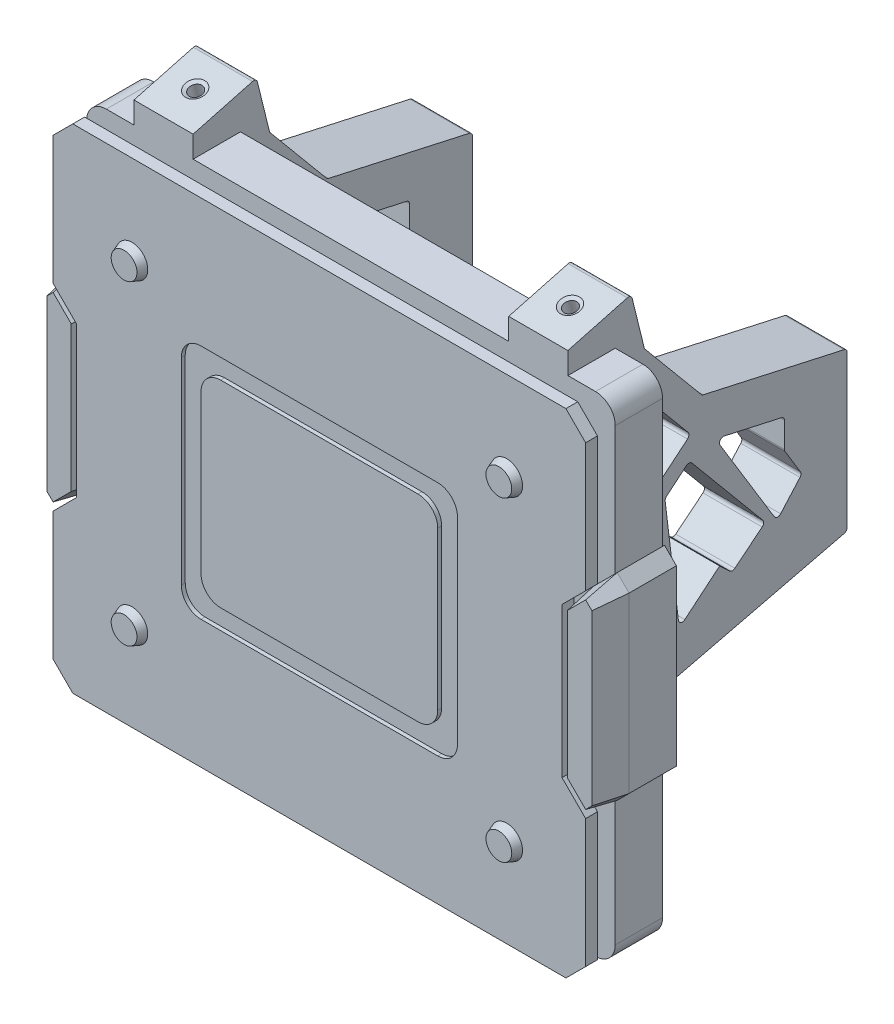
from build123d import *

# Parameters (mm, degrees)
SKETCH_1_W                  = 135
SKETCH_1_H                  = 125
EXTRUDE_1_DEPTH             = 3
SKETCH_3_R                  = 4
EXTRUDE_2_DEPTH             = 2
EXTRUDE_2_DRAFT             = 20
EXTRUDE_2_PROFILE_2_DEPTH   = 2
EXTRUDE_2_PROFILE_2_DRAFT   = 20
EXTRUDE_2_PROFILE_3_DEPTH   = 2
EXTRUDE_2_PROFILE_3_DRAFT   = 20
EXTRUDE_2_PROFILE_4_DEPTH   = 2
EXTRUDE_2_PROFILE_4_DRAFT   = 20
CHAMFER_1_SIZE              = 5
SKETCH_5_W                  = 15
SKETCH_5_H                  = 15
EXTRUDE_4_DEPTH             = 5
MIRROR_3_COPY_1_SKETCH_W    = 15
MIRROR_3_COPY_1_SKETCH_H    = 15
MIRROR_3_COPY_1_DEPTH       = 5
SKETCH_6_W                  = 134
SKETCH_6_H                  = 124
EXTRUDE_6_DEPTH             = 12
FILLET_1_R                  = 5
CUT_EXTRUDE_1_DEPTH         = 1
CUT_EXTRUDE_2_DEPTH         = 3
EXTRUDE_7_DEPTH             = 8
EXTRUDE_7_TAPER             = 10
EXTRUDE_10_REACH            = 98.75
EXTRUDE_11_DEPTH            = 7.5
CUT_EXTRUDE_3_REACH         = 165.252
HOLE_WIZARD_M4_1_AT_2_COUNT = 2
HOLE_WIZARD_M4_1_AT_2_PITCH = 25
HOLE_WIZARD_M4_3_AT_2_COUNT = 2
HOLE_WIZARD_M4_3_AT_2_PITCH = 25
FILLET_2_R                  = 1
FILLET_2_OF_MIRROR_6_R      = 1
SKETCH_24_W                 = 135
SKETCH_24_H                 = 125
EXTRUDE_12_DEPTH            = 150
EXTRUDE_12_TAPER            = -55


with BuildPart() as part:
    # 草图1 → 凸台-拉伸1 (new body)
    with BuildSketch(Plane.XY):
        Rectangle(SKETCH_1_W, SKETCH_1_H)
    extrude(amount=EXTRUDE_1_DEPTH)


with BuildPart() as extrude_2_tool:
    # 草图3 → 凸台-拉伸2 (with draft: the straight prism first)
    with BuildSketch(Plane.XY.offset(3)):
        with Locations((-47.5, 40)):
            Circle(SKETCH_3_R)
    extrude(amount=EXTRUDE_2_DEPTH)
    # 凸台-拉伸2: the draft: its side faces are tilted about the plane it starts from
    extrude_2_sides = [extrude_2_tool.faces().sort_by_distance(p)[0] for p in [
        (-51.5, 40, 4),
    ]]
    draft(extrude_2_sides, Plane.XY.offset(3), EXTRUDE_2_DRAFT)


with BuildPart() as part_1:
    add(part.part)

    # 凸台-拉伸2: add extrude_2_tool
    add(extrude_2_tool.part)


with BuildPart() as extrude_2_profile_2_tool:
    # 草图3 → 凸台-拉伸2 profile 2 (with draft: the straight prism first)
    with BuildSketch(Plane.XY.offset(3)):
        with Locations((47.5, 40)):
            Circle(SKETCH_3_R)
    extrude(amount=EXTRUDE_2_PROFILE_2_DEPTH)
    # 凸台-拉伸2 profile 2: the draft: its side faces are tilted about the plane it starts from
    extrude_2_profile_2_sides = [extrude_2_profile_2_tool.faces().sort_by_distance(p)[0] for p in [
        (43.5, 40, 4),
    ]]
    draft(extrude_2_profile_2_sides, Plane.XY.offset(3), EXTRUDE_2_PROFILE_2_DRAFT)


with BuildPart() as part_2:
    add(part_1.part)

    # 凸台-拉伸2 profile 2: add extrude_2_profile_2_tool
    add(extrude_2_profile_2_tool.part)


with BuildPart() as extrude_2_profile_3_tool:
    # 草图3 → 凸台-拉伸2 profile 3 (with draft: the straight prism first)
    with BuildSketch(Plane.XY.offset(3)):
        with Locations((47.5, -40)):
            Circle(SKETCH_3_R)
    extrude(amount=EXTRUDE_2_PROFILE_3_DEPTH)
    # 凸台-拉伸2 profile 3: the draft: its side faces are tilted about the plane it starts from
    extrude_2_profile_3_sides = [extrude_2_profile_3_tool.faces().sort_by_distance(p)[0] for p in [
        (43.5, -40, 4),
    ]]
    draft(extrude_2_profile_3_sides, Plane.XY.offset(3), EXTRUDE_2_PROFILE_3_DRAFT)


with BuildPart() as part_3:
    add(part_2.part)

    # 凸台-拉伸2 profile 3: add extrude_2_profile_3_tool
    add(extrude_2_profile_3_tool.part)


with BuildPart() as extrude_2_profile_4_tool:
    # 草图3 → 凸台-拉伸2 profile 4 (with draft: the straight prism first)
    with BuildSketch(Plane.XY.offset(3)):
        with Locations((-47.5, -40)):
            Circle(SKETCH_3_R)
    extrude(amount=EXTRUDE_2_PROFILE_4_DEPTH)
    # 凸台-拉伸2 profile 4: the draft: its side faces are tilted about the plane it starts from
    extrude_2_profile_4_sides = [extrude_2_profile_4_tool.faces().sort_by_distance(p)[0] for p in [
        (-51.5, -40, 4),
    ]]
    draft(extrude_2_profile_4_sides, Plane.XY.offset(3), EXTRUDE_2_PROFILE_4_DRAFT)


with BuildPart() as part_4:
    add(part_3.part)

    # 凸台-拉伸2 profile 4: add extrude_2_profile_4_tool
    add(extrude_2_profile_4_tool.part)

    # 倒角1
    chamfer_1_edges = [part_4.edges().sort_by_distance(p)[0] for p in [
        (67.5, -62.5, 1.5),
        (-67.5, -62.5, 1.5),
        (-67.5, 62.5, 1.5),
        (67.5, 62.5, 1.5),
    ]]
    chamfer(chamfer_1_edges, length=CHAMFER_1_SIZE)

    # 草图5 → 凸台-拉伸4 (add)
    with BuildSketch(Plane(origin=(0, 0, 0), x_dir=(-1, 0, 0), z_dir=(0, 0, -1))):
        with Locations((47.5, 40)):
            Rectangle(SKETCH_5_W, SKETCH_5_H)
    extrude_4 = extrude(amount=EXTRUDE_4_DEPTH)

    # 镜向2: 凸台-拉伸4 across plane
    add(extrude_4.mirror(Plane(origin=(0, 0, 0), x_dir=(0, 0, 1), z_dir=(1, 0, 0))))

    # 镜向3: 凸台-拉伸4 across plane
    add(extrude_4.mirror(Plane.ZX))

    # 镜向3 copy 1 sketch → 镜向3 copy 1 (add)
    with BuildSketch(Plane(origin=(0, 0, 0), x_dir=(1, 0, 0), z_dir=(0, 0, -1))):
        with Locations((47.5, 40)):
            Rectangle(MIRROR_3_COPY_1_SKETCH_W, MIRROR_3_COPY_1_SKETCH_H)
    extrude(amount=MIRROR_3_COPY_1_DEPTH)

    # 草图6 → 凸台-拉伸6 (add)
    with BuildSketch(Plane(origin=(0, 0, -5), x_dir=(-1, 0, 0), z_dir=(0, 0, -1))):
        Rectangle(SKETCH_6_W, SKETCH_6_H)
    extrude(amount=EXTRUDE_6_DEPTH)

    # 圆角1
    fillet_1_edges = [part_4.edges().sort_by_distance(p)[0] for p in [
        (-67, -62, -11),
        (-67, 62, -11),
        (67, 62, -11),
        (67, -62, -11),
    ]]
    fillet(fillet_1_edges, radius=FILLET_1_R)

    # 草图7 → 切除-拉伸1 (cut)
    with BuildSketch(Plane.XY.offset(3)):
        with BuildLine():
            Line((-30, -30), (30, -30))
            ThreePointArc((30, -30), (33.535533906, -28.535533906), (35, -25))
            Line((35, -25), (35, 25))
            ThreePointArc((35, 25), (33.535533906, 28.535533906), (30, 30))
            Line((30, 30), (-30, 30))
            ThreePointArc((-30, 30), (-33.535533906, 28.535533906), (-35, 25))
            Line((-35, 25), (-35, -25))
            ThreePointArc((-35, -25), (-33.535533906, -28.535533906), (-30, -30))
        make_face()
        with BuildLine():
            Line((-25, -25), (25, -25))
            ThreePointArc((25, -25), (28.535533906, -23.535533906), (30, -20))
            Line((30, -20), (30, 20))
            ThreePointArc((30, 20), (28.535533906, 23.535533906), (25, 25))
            Line((25, 25), (-25, 25))
            ThreePointArc((-25, 25), (-28.535533906, 23.535533906), (-30, 20))
            Line((-30, 20), (-30, -20))
            ThreePointArc((-30, -20), (-28.535533906, -23.535533906), (-25, -25))
        make_face(mode=Mode.SUBTRACT)
    extrude(amount=-CUT_EXTRUDE_1_DEPTH, mode=Mode.SUBTRACT)

    # 草图4 → 切除-拉伸2 (cut)
    with BuildSketch(Plane.XY.offset(3)):
        Polygon((-67.5, 25), (-70.5, 22), (-70.5, -22), (-67.5, -25), (-61.5, -19), (-61.5, 19), align=None)
    cut_extrude_2 = extrude(amount=-CUT_EXTRUDE_2_DEPTH, mode=Mode.SUBTRACT)

    # 镜向4: 切除-拉伸2 across plane
    add(cut_extrude_2.mirror(Plane(origin=(0, 0, 0), x_dir=(0, 0, 1), z_dir=(1, 0, 0))), mode=Mode.SUBTRACT)

    # 草图8 → 凸台-拉伸7 (add)
    with BuildSketch(Plane.XY.offset(-5)):
        Polygon((61.5, 19), (61.5, -19), (67.5, -25), (70.5, -22), (70.5, 22), (67.5, 25), align=None)
    extrude_7 = extrude(amount=EXTRUDE_7_DEPTH, taper=EXTRUDE_7_TAPER)

    # 镜向5: 凸台-拉伸7 across plane
    add(extrude_7.mirror(Plane(origin=(0, 0, 0), x_dir=(0, 0, 1), z_dir=(1, 0, 0))))

    # 凸台-拉伸10: up to this face of the body (flat: up to its plane)
    extrude_10_end = Plane(part_4.part.faces().sort_by_distance((0, 0, -5))[0])
    # 草图9 → 凸台-拉伸10 (add, up to the picked face)
    with BuildSketch(Plane(origin=(0, 0, -17), x_dir=(-1, 0, 0), z_dir=(0, 0, -1)), mode=Mode.PRIVATE) as extrude_10_sk1:
        Polygon((-67.5, 25), (-70.5, 22), (-70.5, -22), (-67.5, -25), (-67, -24.5), (-67, 24.5), align=None)
    extrude_10_tool1 = split(extrude(extrude_10_sk1.sketch, amount=-EXTRUDE_10_REACH, mode=Mode.PRIVATE), bisect_by=extrude_10_end, keep=Keep.BOTH, mode=Mode.PRIVATE)
    # 草图9 → 凸台-拉伸10 (add, up to the picked face)
    with BuildSketch(Plane(origin=(0, 0, -17), x_dir=(-1, 0, 0), z_dir=(0, 0, -1)), mode=Mode.PRIVATE) as extrude_10_sk2:
        Polygon((70.5, 22), (67.5, 25), (67, 24.5), (67, -24.5), (67.5, -25), (70.5, -22), align=None)
    extrude_10_tool2 = split(extrude(extrude_10_sk2.sketch, amount=-EXTRUDE_10_REACH, mode=Mode.PRIVATE), bisect_by=extrude_10_end, keep=Keep.BOTH, mode=Mode.PRIVATE)
    add(extrude_10_tool1.solids().sort_by(Axis((68.711664, 0, -17), (0, 0, 1)))[0])
    add(extrude_10_tool2.solids().sort_by(Axis((-68.711664, 0, -17), (0, 0, 1)))[0])

    # 草图10 → 凸台-拉伸11 (add, symmetric)
    with BuildSketch(Plane(origin=(47.5, 0, 0), x_dir=(0, 0, -1), z_dir=(1, 0, 0))):
        Polygon((5, 62), (5, 67.5), (21.047818473, 71.8), (24.4, 58.207249027), (39, 40.694967622), (75.8, 32.506561184), (75.8, -7.493438816), (25.1, -19.785635149), (21.5, -54.6), (17, -54.6), align=None)
    extrude_11 = extrude(amount=EXTRUDE_11_DEPTH, both=True)

    # 草图11 → 切除-拉伸3 (cut, up to next)
    with BuildSketch(Plane(origin=(55, 0, 0), x_dir=(0, 0, -1), z_dir=(1, 0, 0)), mode=Mode.PRIVATE) as cut_extrude_3_sk1:
        with BuildLine():
            Line((21.817771948, 50.665411933), (35.450369453, 34.313502085))
            ThreePointArc((35.450369453, 34.313502085), (35.678199739, 33.582831298), (35.322637812, 32.90506869))
            Line((35.322637812, 32.90506869), (27.612126254, 26.476810364))
            ThreePointArc((27.612126254, 26.476810364), (27.312302528, 26.304658198), (26.971775377, 26.244892881))
            Line((26.971775377, 26.244892881), (21.04968943, 26.244892881))
            ThreePointArc((21.04968943, 26.244892881), (20.342582649, 26.5377861), (20.04968943, 27.244892881))
            Line((20.04968943, 27.244892881), (20.04968943, 50.025061056))
            ThreePointArc((20.04968943, 50.025061056), (20.709162278, 50.965295739), (21.817771948, 50.665411933))
        make_face()
    cut_extrude_3_tool1 = extrude(cut_extrude_3_sk1.sketch, amount=-CUT_EXTRUDE_3_REACH, mode=Mode.PRIVATE) & part_4.part
    # 草图11 → 切除-拉伸3 (cut, up to next)
    with BuildSketch(Plane(origin=(55, 0, 0), x_dir=(0, 0, -1), z_dir=(1, 0, 0)), mode=Mode.PRIVATE) as cut_extrude_3_sk2:
        with BuildLine():
            Line((30.009110807, 23.006353208), (35.03843222, 27.199301628))
            ThreePointArc((35.03843222, 27.199301628), (35.769103007, 27.427131915), (36.446865615, 27.071569987))
            Line((36.446865615, 27.071569987), (54.386144286, 5.553919558))
            ThreePointArc((54.386144286, 5.553919558), (54.613305384, 4.816151304), (54.24739667, 4.13643447))
            Line((54.24739667, 4.13643447), (47.330260881, -1.465165505))
            ThreePointArc((47.330260881, -1.465165505), (46.665548967, -1.687405332), (46.018215391, -1.418720183))
            Line((46.018215391, -1.418720183), (43.458929869, 0.972518208))
            Line((43.458929869, 0.972518208), (34.637798998, -6.381664135))
            ThreePointArc((34.637798998, -6.381664135), (33.628288887, -6.542947778), (33.004595611, -5.732929398))
            Line((33.004595611, -5.732929398), (29.656609173, 22.118922911))
            ThreePointArc((29.656609173, 22.118922911), (29.720095524, 22.607429925), (30.009110807, 23.006353208))
        make_face()
    cut_extrude_3_tool2 = extrude(cut_extrude_3_sk2.sketch, amount=-CUT_EXTRUDE_3_REACH, mode=Mode.PRIVATE) & part_4.part
    # 草图11 → 切除-拉伸3 (cut, up to next)
    with BuildSketch(Plane(origin=(55, 0, 0), x_dir=(0, 0, -1), z_dir=(1, 0, 0)), mode=Mode.PRIVATE) as cut_extrude_3_sk3:
        with BuildLine():
            Line((43.588136397, 27.411360751), (57.324671556, 4.832917904))
            ThreePointArc((57.324671556, 4.832917904), (58.089924198, 4.35664916), (58.927534081, 4.689595411))
            Line((58.927534081, 4.689595411), (63.833036207, 10.227399947))
            ThreePointArc((63.833036207, 10.227399947), (64.080513731, 10.80141859), (63.938801479, 11.410237254))
            Line((63.938801479, 11.410237254), (60.034496509, 17.827658068))
            ThreePointArc((60.034496509, 17.827658068), (59.925920513, 18.077520957), (59.888810407, 18.347415475))
            Line((59.888810407, 18.347415475), (59.888810407, 24.71664348))
            ThreePointArc((59.888810407, 24.71664348), (59.668938317, 25.342263528), (59.106009517, 25.692770801))
            Line((59.106009517, 25.692770801), (44.659649405, 28.907245479))
            ThreePointArc((44.659649405, 28.907245479), (43.629494827, 28.513444017), (43.588136397, 27.411360751))
        make_face()
    cut_extrude_3_tool3 = extrude(cut_extrude_3_sk3.sketch, amount=-CUT_EXTRUDE_3_REACH, mode=Mode.PRIVATE) & part_4.part
    cut_extrude_3_1 = cut_extrude_3_tool1.solids().sort_by_distance((55, 36.458799, -25.695264))[0]
    add(cut_extrude_3_1, mode=Mode.SUBTRACT)
    cut_extrude_3_2 = cut_extrude_3_tool2.solids().sort_by_distance((55, 9.913689, -39.670102))[0]
    add(cut_extrude_3_2, mode=Mode.SUBTRACT)
    cut_extrude_3_3 = cut_extrude_3_tool3.solids().sort_by_distance((55, 18.00048, -54.817804))[0]
    add(cut_extrude_3_3, mode=Mode.SUBTRACT)
    cut_extrude_3 = cut_extrude_3_1 + cut_extrude_3_2 + cut_extrude_3_3  # 切除-拉伸3 as one shape, for the pattern or mirror that repeats it

    # 草图15 → M4 螺纹孔1 (revolve, cut)
    with BuildSketch(Plane(origin=(47.484304727, 25.006561184, -75.8), x_dir=(0, 1, 0), z_dir=(1, 0, 0))):
        Polygon((0, 0), (0, 10.991420021), (1.65, 10), (1.65, 0), align=None)
    hole_wizard_m4_1 = revolve(axis=Axis((47.484304727, 25.006561184, -82.15), (0, 0, 1)), mode=Mode.SUBTRACT)

    # M4 螺纹孔1 at 2: M4 螺纹孔1 ×2
    with Locations(*[(0, -i * HOLE_WIZARD_M4_1_AT_2_PITCH, 0) for i in range(1, HOLE_WIZARD_M4_1_AT_2_COUNT)]):
        add(hole_wizard_m4_1, mode=Mode.SUBTRACT)

    # 草图18 → M4 螺纹孔2 (revolve, cut)
    with BuildSketch(Plane(origin=(47.5, 69.65, -13.023909236), x_dir=(0, -0.25881904510252207, 0.9659258262890679), z_dir=(1, 0, 0))):
        Polygon((0, 0), (0, 11.091420021), (1.65, 10.1), (1.65, 0), align=None)
    hole_wizard_m4_2 = revolve(axis=Axis((47.5, 75.783628997, -11.3804083), (0, -0.9659258262890679, -0.2588190451025221)), mode=Mode.SUBTRACT)

    # 切除-拉伸4 cone 1 section (through the dimple's axis) → 切除-拉伸4 (revolve, cut)
    with BuildSketch(Plane(origin=(47.5, 69.65, -13.023909236), x_dir=(0, -0.258819045, 0.965925826), z_dir=(1, 0, 0))):
        Polygon((0, 0), (2.5, 0), (0, 1.443375673), align=None)
    cut_extrude_4 = revolve(axis=Axis((47.5, 69.65, -13.023909236), (0, -0.965925826, -0.258819045)), mode=Mode.SUBTRACT)

    # 草图22 → M4 螺纹孔3 (revolve, cut)
    with BuildSketch(Plane(origin=(47.5, -11.263412103, -60.250488708), x_dir=(0, 0.23562333046964068, -0.9718444557327034), z_dir=(1, 0, 0))):
        Polygon((0, 0), (0, 11.091420021), (1.65, 10.1), (1.65, 0), align=None)
    hole_wizard_m4_3 = revolve(axis=Axis((47.5, -17.434624397, -61.746696857), (0, 0.9718444557327034, 0.2356233304696407)), mode=Mode.SUBTRACT)

    # M4 螺纹孔3 at 2: M4 螺纹孔3 ×2
    with Locations(*[Vector(0, -0.2356233304696407, 0.9718444557327034) * (i * HOLE_WIZARD_M4_3_AT_2_PITCH) for i in range(1, HOLE_WIZARD_M4_3_AT_2_COUNT)]):
        add(hole_wizard_m4_3, mode=Mode.SUBTRACT)

    # 圆角2
    fillet_2_edges = [part_4.edges().sort_by_distance(p)[0] for p in [
        (47.5, -54.6, -21.5),
        (47.5, -19.785635149, -25.1),
        (47.5, -7.493438816, -75.8),
        (47.5, 32.506561184, -75.8),
        (47.5, 40.694967622, -39),
        (47.5, 58.207249027, -24.4),
        (47.5, 71.8, -21.047818473),
    ]]
    fillet(fillet_2_edges, radius=FILLET_2_R)

    # 镜向6: 凸台-拉伸11, 切除-拉伸3, M4 螺纹孔1, M4 螺纹孔2, 切除-拉伸4, M4 螺纹孔3 across plane
    add(extrude_11.mirror(Plane(origin=(0, 0, 0), x_dir=(0, 0, 1), z_dir=(1, 0, 0))))
    add(cut_extrude_3.mirror(Plane(origin=(0, 0, 0), x_dir=(0, 0, 1), z_dir=(1, 0, 0))), mode=Mode.SUBTRACT)
    add(hole_wizard_m4_1.mirror(Plane(origin=(0, 0, 0), x_dir=(0, 0, 1), z_dir=(1, 0, 0))), mode=Mode.SUBTRACT)
    add(hole_wizard_m4_2.mirror(Plane(origin=(0, 0, 0), x_dir=(0, 0, 1), z_dir=(1, 0, 0))), mode=Mode.SUBTRACT)
    add(cut_extrude_4.mirror(Plane(origin=(0, 0, 0), x_dir=(0, 0, 1), z_dir=(1, 0, 0))), mode=Mode.SUBTRACT)
    add(hole_wizard_m4_3.mirror(Plane(origin=(0, 0, 0), x_dir=(0, 0, 1), z_dir=(1, 0, 0))), mode=Mode.SUBTRACT)

    # 镜向6 copy 1 sketch → 镜向6 copy 1 (revolve, cut)
    with BuildSketch(Plane(origin=(-47.484304727, 0.006561184, -75.8), x_dir=(0, 1, 0), z_dir=(-1, 0, 0))):
        Polygon((0, 0), (0, -10.991420021), (1.65, -10), (1.65, 0), align=None)
    revolve(axis=Axis((-47.484304727, 0.006561184, -82.15), (0, 0, -1)), mode=Mode.SUBTRACT)

    # 镜向6 copy 2 sketch → 镜向6 copy 2 (revolve, cut)
    with BuildSketch(Plane(origin=(-47.5, -17.153995365, -35.954377315), x_dir=(0, 0.23562333046964068, -0.9718444557327034), z_dir=(-1, 0, 0))):
        Polygon((0, 0), (0, -11.091420021), (1.65, -10.1), (1.65, 0), align=None)
    revolve(axis=Axis((-47.5, -23.325207659, -37.450585463), (0, -0.9718444557327034, -0.2356233304696407)), mode=Mode.SUBTRACT)

    # 圆角2 of 镜向6
    fillet_2_of_mirror_6_edges = [part_4.edges().sort_by_distance(p)[0] for p in [
        (-47.5, -54.6, -21.5),
        (-47.5, -19.785635149, -25.1),
        (-47.5, -7.493438816, -75.8),
        (-47.5, 32.506561184, -75.8),
        (-47.5, 40.694967622, -39),
        (-47.5, 58.207249027, -24.4),
        (-47.5, 71.8, -21.047818473),
    ]]
    fillet(fillet_2_of_mirror_6_edges, radius=FILLET_2_OF_MIRROR_6_R)


with BuildPart() as body_2:
    # 草图24 → 凸台-拉伸12 (new body)
    with BuildSketch(Plane.XY.offset(3)):
        Rectangle(SKETCH_24_W, SKETCH_24_H)
    extrude(amount=EXTRUDE_12_DEPTH, taper=EXTRUDE_12_TAPER)


solid = part_4.part
